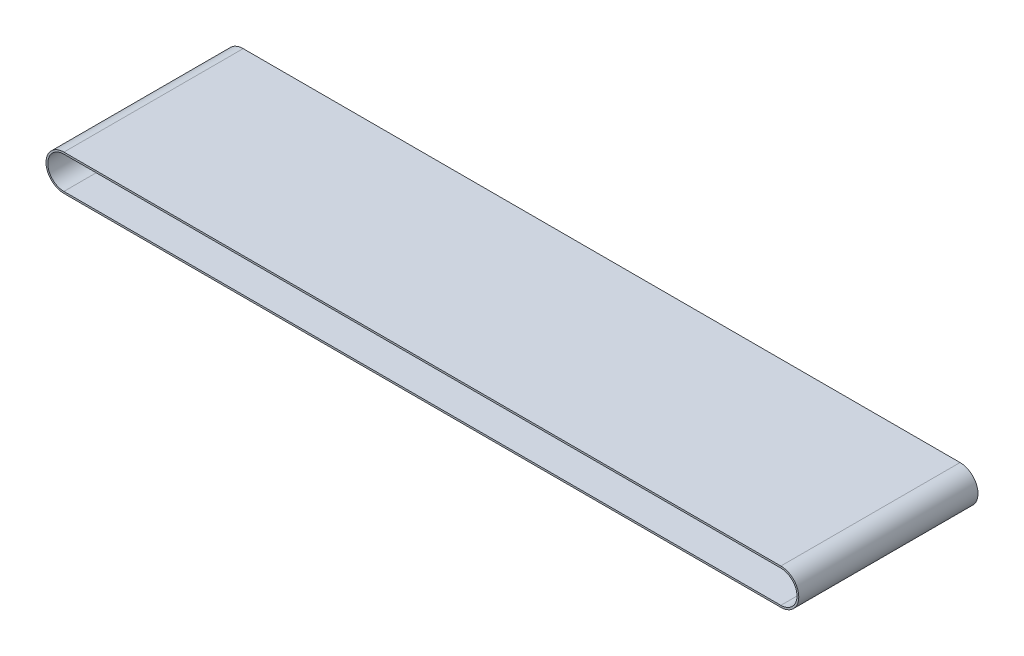
from build123d import *

# Parameters (mm, degrees)
BOSS_EXTRUDE1_DEPTH = 1000


with BuildPart() as part:
    # Sketch1 → Boss-Extrude1 (new body)
    with BuildSketch(Plane.XY):
        with BuildLine():
            Line((0, 100), (4000, 100))
            ThreePointArc((4000, 100), (4100, 0), (4000, -100))
            Line((4000, -100), (0, -100))
            ThreePointArc((0, -100), (-100, 0), (0, 100))
        make_face()
        with BuildLine():
            Line((0, 90), (4000, 90))
            ThreePointArc((4000, 90), (4090, 0), (4000, -90))
            Line((4000, -90), (0, -90))
            ThreePointArc((0, -90), (-90, 0), (0, 90))
        make_face(mode=Mode.SUBTRACT)
    extrude(amount=BOSS_EXTRUDE1_DEPTH)


solid = part.part
